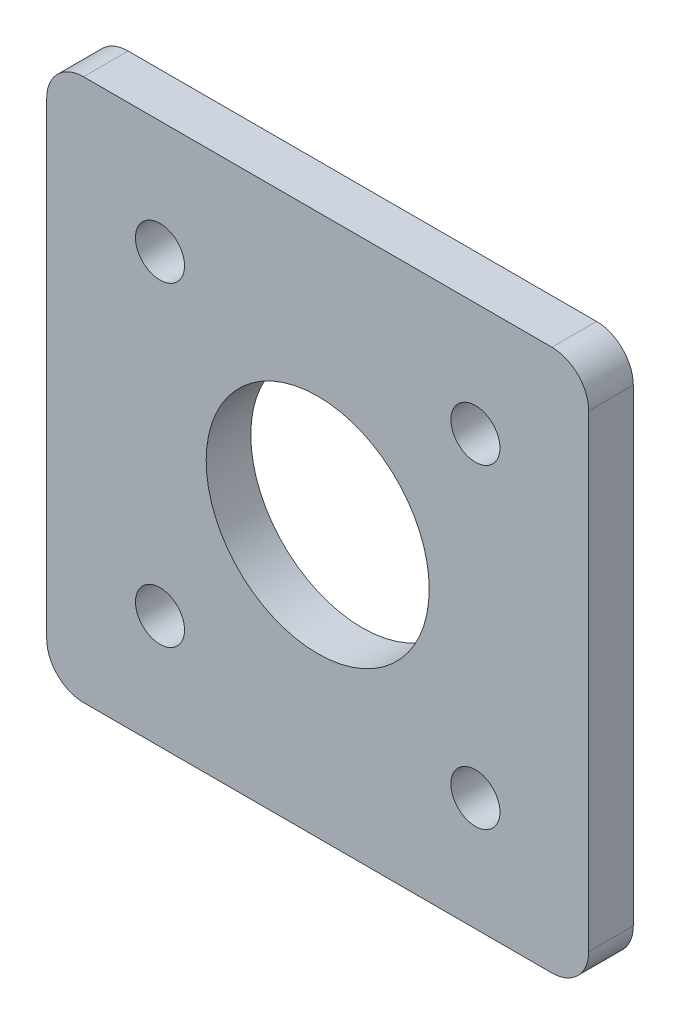
from build123d import *

# Parameters (mm, degrees)
CROQUIS1_R              = 5
CROQUIS1_R_2            = 1.1
SALIENTE_EXTRUIR1_DEPTH = 2
CORTAR_EXTRUIR1_START   = -2
CORTAR_EXTRUIR1_DEPTH   = 2


with BuildPart() as part:
    # Croquis1 → Saliente-Extruir1 (new body)
    with BuildSketch(Plane.XY):
        with BuildLine():
            Line((-18.543218985, -0.988325299), (-18.543218985, -21.988325299))
            ThreePointArc((-18.543218985, -21.988325299), (-17.957432547, -23.402538861), (-16.543218985, -23.988325299))
            Line((-16.543218985, -23.988325299), (4.456781015, -23.988325299))
            ThreePointArc((4.456781015, -23.988325299), (5.870994578, -23.402538861), (6.456781015, -21.988325299))
            Line((6.456781015, -21.988325299), (6.456781015, -0.988325299))
            ThreePointArc((6.456781015, -0.988325299), (5.870994578, 0.425888264), (4.456781015, 1.011674701))
            Line((4.456781015, 1.011674701), (-16.543218985, 1.011674701))
            ThreePointArc((-16.543218985, 1.011674701), (-17.957432547, 0.425888264), (-18.543218985, -0.988325299))
        make_face()
        with Locations((-6.043218985, -11.488325299)):
            Circle(CROQUIS1_R, mode=Mode.SUBTRACT)
        with Locations((-13.114286796, -4.417257487)):
            Circle(CROQUIS1_R_2, mode=Mode.SUBTRACT)
        with Locations((1.027848827, -4.417257487)):
            Circle(CROQUIS1_R_2, mode=Mode.SUBTRACT)
        with Locations((-13.114286796, -18.559393111)):
            Circle(CROQUIS1_R_2, mode=Mode.SUBTRACT)
        with Locations((1.027848827, -18.559393111)):
            Circle(CROQUIS1_R_2, mode=Mode.SUBTRACT)
    extrude(amount=SALIENTE_EXTRUIR1_DEPTH)

    # Croquis2 → Cortar-Extruir1 (cut)
    with BuildSketch(Plane.XY.offset(2).offset(CORTAR_EXTRUIR1_START)):
        with BuildLine():
            Line((4.456781015, 1.011674701), (-16.543218985, 1.011674701))
            ThreePointArc((-16.543218985, 1.011674701), (-17.957432547, 0.425888264), (-18.543218985, -0.988325299))
            Line((-18.543218985, -0.988325299), (-18.543218985, -21.988325299))
            ThreePointArc((-18.543218985, -21.988325299), (-17.957432547, -23.402538861), (-16.543218985, -23.988325299))
            Line((-16.543218985, -23.988325299), (4.456781015, -23.988325299))
            ThreePointArc((4.456781015, -23.988325299), (5.870994578, -23.402538861), (6.456781015, -21.988325299))
            Line((6.456781015, -21.988325299), (6.456781015, -0.988325299))
            ThreePointArc((6.456781015, -0.988325299), (5.870994578, 0.425888264), (4.456781015, 1.011674701))
        make_face()
        with BuildLine():
            Line((-18.193218985, -0.988325299), (-18.193218985, -21.988325299))
            ThreePointArc((-18.193218985, -21.988325299), (-17.709945174, -23.155051488), (-16.543218985, -23.638325299))
            Line((-16.543218985, -23.638325299), (4.456781015, -23.638325299))
            ThreePointArc((4.456781015, -23.638325299), (5.623507204, -23.155051488), (6.106781015, -21.988325299))
            Line((6.106781015, -21.988325299), (6.106781015, -0.988325299))
            ThreePointArc((6.106781015, -0.988325299), (5.623507204, 0.17840089), (4.456781015, 0.661674701))
            Line((4.456781015, 0.661674701), (-16.543218985, 0.661674701))
            ThreePointArc((-16.543218985, 0.661674701), (-17.709945174, 0.17840089), (-18.193218985, -0.988325299))
        make_face(mode=Mode.SUBTRACT)
    extrude(amount=CORTAR_EXTRUIR1_DEPTH, mode=Mode.SUBTRACT)


solid = part.part
